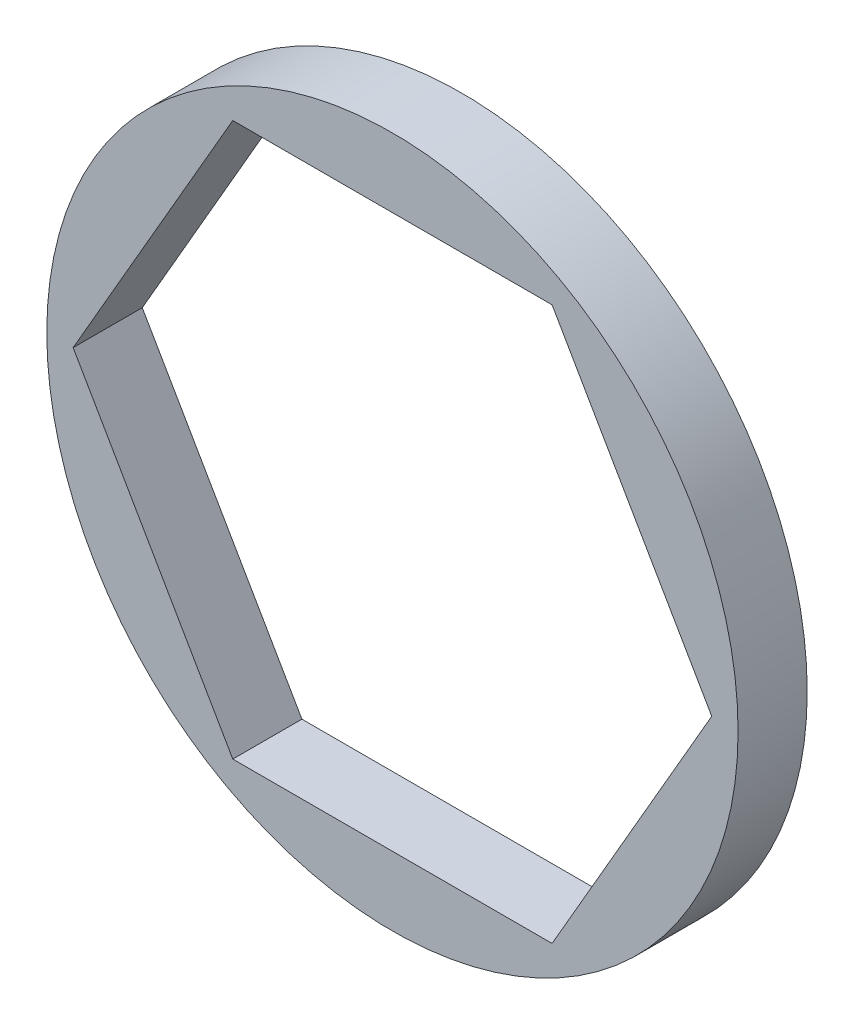
from build123d import *

# Parameters (mm, degrees)
SKETCH1_R           = 7.9375
BOSS_EXTRUDE1_DEPTH = 1.5875


with BuildPart() as part:
    # Sketch1 → Boss-Extrude1 (new body)
    with BuildSketch(Plane.XY):
        Circle(SKETCH1_R)
        Polygon((-3.666174209, -6.35), (3.666174209, -6.35), (7.332348419, 0), (3.666174209, 6.35), (-3.666174209, 6.35), (-7.332348419, 0), align=None, mode=Mode.SUBTRACT)
    extrude(amount=BOSS_EXTRUDE1_DEPTH)


solid = part.part
